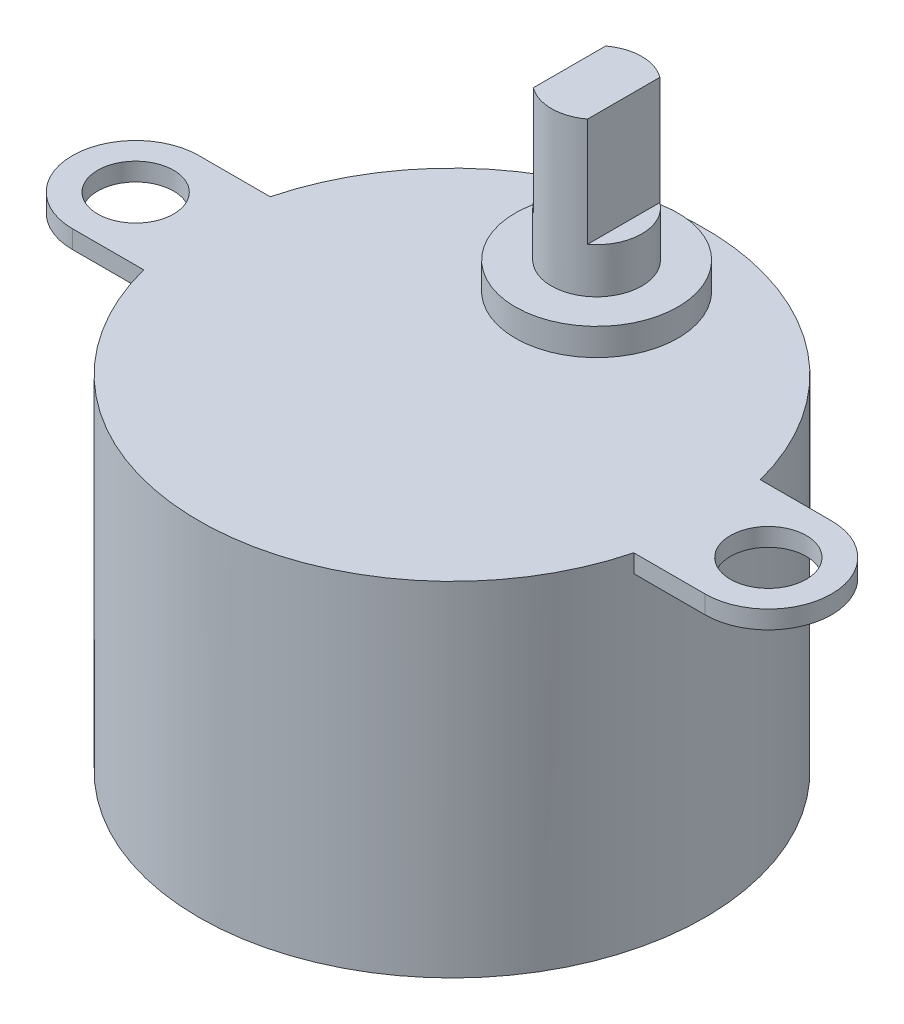
from build123d import *

# Parameters (mm, degrees)
SKETCH_1_R      = 14
EXTRUDE_1_DEPTH = 19
SKETCH_2_R      = 2.1
EXTRUDE_2_DEPTH = 1
SKETCH_3_R      = 4.5
EXTRUDE_3_DEPTH = 1.5
SKETCH_4_R      = 2.5
EXTRUDE_4_DEPTH = 2.5
EXTRUDE_5_DEPTH = 6


with BuildPart() as part:
    # 草图1 → 凸台-拉伸1 (new body)
    with BuildSketch(Plane(origin=(0, 0, 0), x_dir=(1, 0, 0), z_dir=(0, 1, 0))):
        with Locations(Location((0, 0, 0), (0, 0, 270))):
            Circle(SKETCH_1_R)
    extrude(amount=EXTRUDE_1_DEPTH)

    # 草图2 → 凸台-拉伸2 (add)
    with BuildSketch(Plane(origin=(0, 19, 0), x_dir=(1, 0, 0), z_dir=(0, 1, 0))):
        with BuildLine():
            Line((-17.5, 3.5), (17.5, 3.5))
            ThreePointArc((17.5, 3.5), (21, 0), (17.5, -3.5))
            Line((17.5, -3.5), (-17.5, -3.5))
            ThreePointArc((-17.5, -3.5), (-21, 0), (-17.5, 3.5))
        make_face()
        with Locations(Location((-17.5, 0, 0), (0, 0, 270))):
            Circle(SKETCH_2_R, mode=Mode.SUBTRACT)
        with Locations(Location((17.5, 0, 0), (0, 0, 270))):
            Circle(SKETCH_2_R, mode=Mode.SUBTRACT)
    extrude(amount=-EXTRUDE_2_DEPTH)

    # 草图3 → 凸台-拉伸3 (add)
    with BuildSketch(Plane(origin=(0, 19, 0), x_dir=(1, 0, 0), z_dir=(0, 1, 0))):
        with Locations(Location((0, 8, 0), (0, 0, 270))):
            Circle(SKETCH_3_R)
    extrude(amount=EXTRUDE_3_DEPTH)

    # 草图4 → 凸台-拉伸4 (add)
    with BuildSketch(Plane(origin=(0, 20.5, 0), x_dir=(1, 0, 0), z_dir=(0, 1, 0))):
        with Locations(Location((0, 8, 0), (0, 0, 270))):
            Circle(SKETCH_4_R)
    extrude(amount=EXTRUDE_4_DEPTH)

    # 草图5 → 凸台-拉伸5 (add)
    with BuildSketch(Plane(origin=(0, 23, 0), x_dir=(1, 0, 0), z_dir=(0, 1, 0))):
        with BuildLine():
            Line((-1.5, 10), (-1.5, 6))
            ThreePointArc((-1.5, 6), (0, 5.5), (1.5, 6))
            Line((1.5, 6), (1.5, 10))
            ThreePointArc((1.5, 10), (0, 10.5), (-1.5, 10))
        make_face()
    extrude(amount=EXTRUDE_5_DEPTH)


solid = part.part
